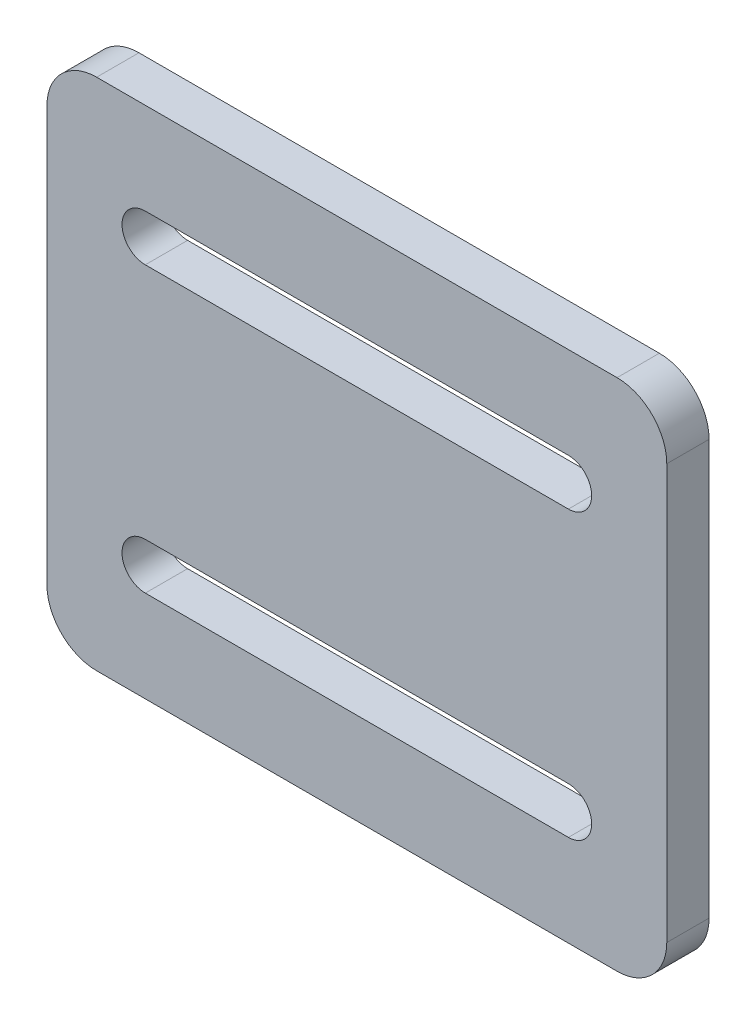
from build123d import *

# Parameters (mm, degrees)
SALIENTE_EXTRUIR1_DEPTH = 2
CORTAR_EXTRUIR1_START   = -2
CORTAR_EXTRUIR1_DEPTH   = 2


with BuildPart() as part:
    # Croquis1 → Saliente-Extruir1 (new body)
    with BuildSketch(Plane.XY):
        with BuildLine():
            Line((-39.554396855, 20.88242961), (-39.554396855, 1.28242961))
            ThreePointArc((-39.554396855, 1.28242961), (-38.763585164, -0.626758699), (-36.854396855, -1.41757039))
            Line((-36.854396855, -1.41757039), (-12.254396855, -1.41757039))
            ThreePointArc((-12.254396855, -1.41757039), (-10.345208546, -0.626758699), (-9.554396855, 1.28242961))
            Line((-9.554396855, 1.28242961), (-9.554396855, 20.88242961))
            ThreePointArc((-9.554396855, 20.88242961), (-10.345208546, 22.791617919), (-12.254396855, 23.58242961))
            Line((-12.254396855, 23.58242961), (-36.854396855, 23.58242961))
            ThreePointArc((-36.854396855, 23.58242961), (-38.763585164, 22.791617919), (-39.554396855, 20.88242961))
        make_face()
        with BuildLine():
            Line((-14.554396855, 18.90242961), (-34.554396855, 18.90242961))
            ThreePointArc((-34.554396855, 18.90242961), (-35.654396855, 17.80242961), (-34.554396855, 16.70242961))
            Line((-34.554396855, 16.70242961), (-14.554396855, 16.70242961))
            ThreePointArc((-14.554396855, 16.70242961), (-13.454396855, 17.80242961), (-14.554396855, 18.90242961))
        make_face(mode=Mode.SUBTRACT)
        with BuildLine():
            Line((-34.554396855, 3.26242961), (-14.554396855, 3.26242961))
            ThreePointArc((-14.554396855, 3.26242961), (-13.454396855, 4.36242961), (-14.554396855, 5.46242961))
            Line((-14.554396855, 5.46242961), (-34.554396855, 5.46242961))
            ThreePointArc((-34.554396855, 5.46242961), (-35.654396855, 4.36242961), (-34.554396855, 3.26242961))
        make_face(mode=Mode.SUBTRACT)
    extrude(amount=SALIENTE_EXTRUIR1_DEPTH)

    # Croquis2 → Cortar-Extruir1 (cut)
    with BuildSketch(Plane.XY.offset(2).offset(CORTAR_EXTRUIR1_START)):
        with BuildLine():
            Line((-39.554396855, 20.88242961), (-39.554396855, 1.28242961))
            ThreePointArc((-39.554396855, 1.28242961), (-38.763585164, -0.626758699), (-36.854396855, -1.41757039))
            Line((-36.854396855, -1.41757039), (-12.254396855, -1.41757039))
            ThreePointArc((-12.254396855, -1.41757039), (-10.345208546, -0.626758699), (-9.554396855, 1.28242961))
            Line((-9.554396855, 1.28242961), (-9.554396855, 20.88242961))
            ThreePointArc((-9.554396855, 20.88242961), (-10.345208546, 22.791617919), (-12.254396855, 23.58242961))
            Line((-12.254396855, 23.58242961), (-36.854396855, 23.58242961))
            ThreePointArc((-36.854396855, 23.58242961), (-38.763585164, 22.791617919), (-39.554396855, 20.88242961))
        make_face()
        with BuildLine():
            Line((-39.204396855, 20.88242961), (-39.204396855, 1.28242961))
            ThreePointArc((-39.204396855, 1.28242961), (-38.516097791, -0.379271326), (-36.854396855, -1.06757039))
            Line((-36.854396855, -1.06757039), (-12.254396855, -1.06757039))
            ThreePointArc((-12.254396855, -1.06757039), (-10.592695919, -0.379271326), (-9.904396855, 1.28242961))
            Line((-9.904396855, 1.28242961), (-9.904396855, 20.88242961))
            ThreePointArc((-9.904396855, 20.88242961), (-10.592695919, 22.544130546), (-12.254396855, 23.23242961))
            Line((-12.254396855, 23.23242961), (-36.854396855, 23.23242961))
            ThreePointArc((-36.854396855, 23.23242961), (-38.516097791, 22.544130546), (-39.204396855, 20.88242961))
        make_face(mode=Mode.SUBTRACT)
    extrude(amount=CORTAR_EXTRUIR1_DEPTH, mode=Mode.SUBTRACT)


solid = part.part
